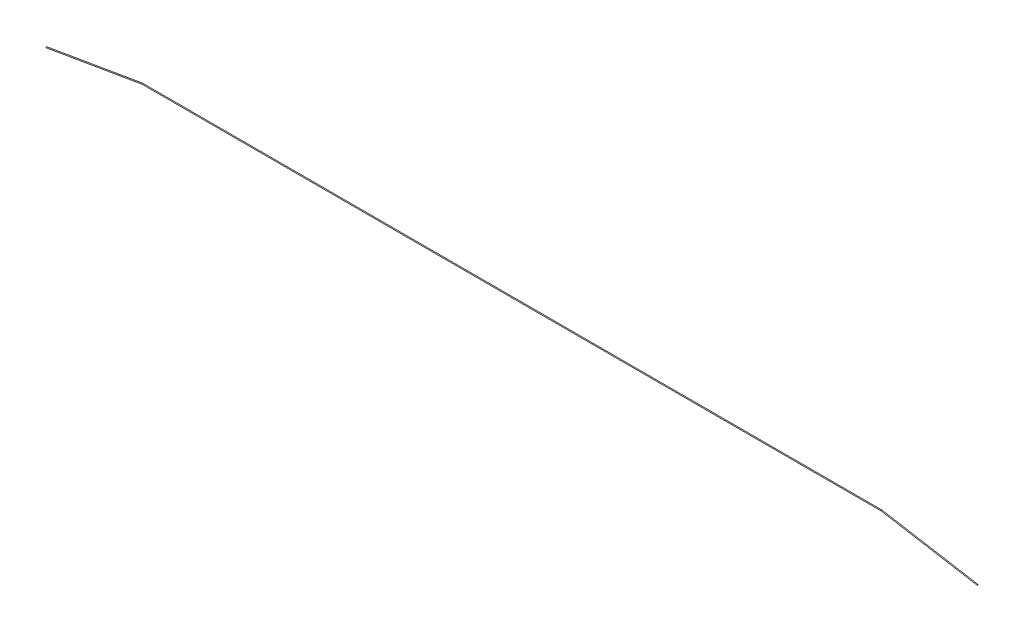
from build123d import *

# Parameters (mm, degrees)
SWEEP1_PROFILE_R = 0.0254


with BuildPart() as part:
    # Sweep1: sweep along a path in Sketch1
    with BuildLine(Plane.XY) as sweep1_path:
        Line((27.18990625, 23.6140625), (21.59, 24.570612141))
        Line((21.59, 24.570612141), (-21.59, 24.570612141))
        Line((-21.59, 24.570612141), (-27.18990625, 23.6140625))
    # Sweep1 profile (on start of the path) → Sweep1 (sweep)
    with BuildSketch(Plane(origin=(27.18990625, 23.6140625, 0), x_dir=(-0.16837652342244658, -0.9857227532933235, 0), z_dir=(-0.9857227532933235, 0.16837652342244658, 0))):
        Circle(SWEEP1_PROFILE_R)
    sweep(path=sweep1_path.line, transition=Transition.RIGHT)


solid = part.part
